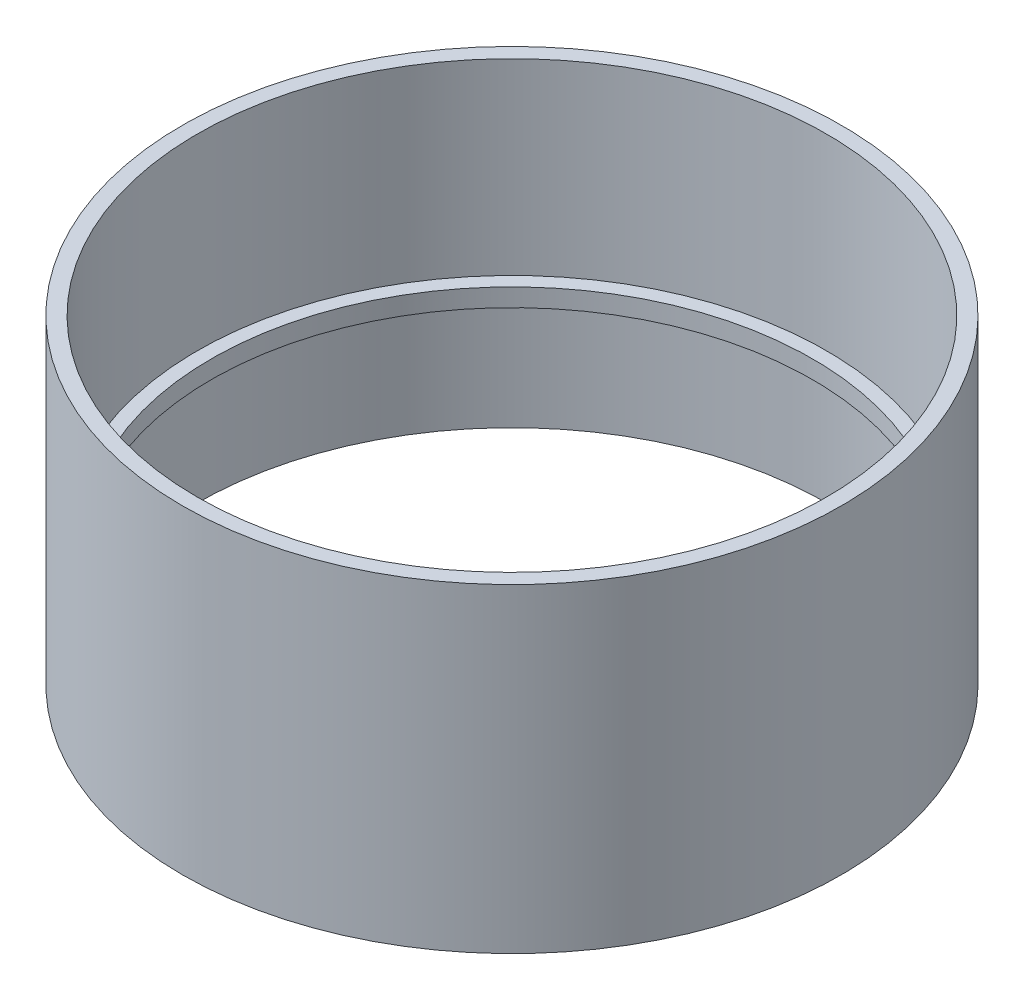
from build123d import *

# Parameters (mm, degrees)
CROQUIS2_R              = 83.82
CROQUIS2_R_2            = 80.01
SALIENTE_EXTRUIR1_DEPTH = 81.28
CROQUIS4_R              = 80.01
CROQUIS4_R_2            = 76.454
SALIENTE_EXTRUIR2_DEPTH = 4.572


with BuildPart() as part:
    # Croquis2 → Saliente-Extruir1 (new body)
    with BuildSketch(Plane(origin=(0, 0, 0), x_dir=(1, 0, 0), z_dir=(0, 1, 0))):
        with Locations(Location((0, 0, 0), (0, 0, 270))):
            Circle(CROQUIS2_R)
        with Locations(Location((0, 0, 0), (0, 0, 270))):
            Circle(CROQUIS2_R_2, mode=Mode.SUBTRACT)
    extrude(amount=-SALIENTE_EXTRUIR1_DEPTH)

    # Croquis4 → Saliente-Extruir2 (add)
    with BuildSketch(Plane(origin=(0, -47.752, 0), x_dir=(1, 0, 0), z_dir=(0, 1, 0))):
        with Locations(Location((0, 0, 0), (0, 0, 270))):
            Circle(CROQUIS4_R)
        with Locations(Location((0, 0, 0), (0, 0, 270))):
            Circle(CROQUIS4_R_2, mode=Mode.SUBTRACT)
    extrude(amount=-SALIENTE_EXTRUIR2_DEPTH)


solid = part.part
